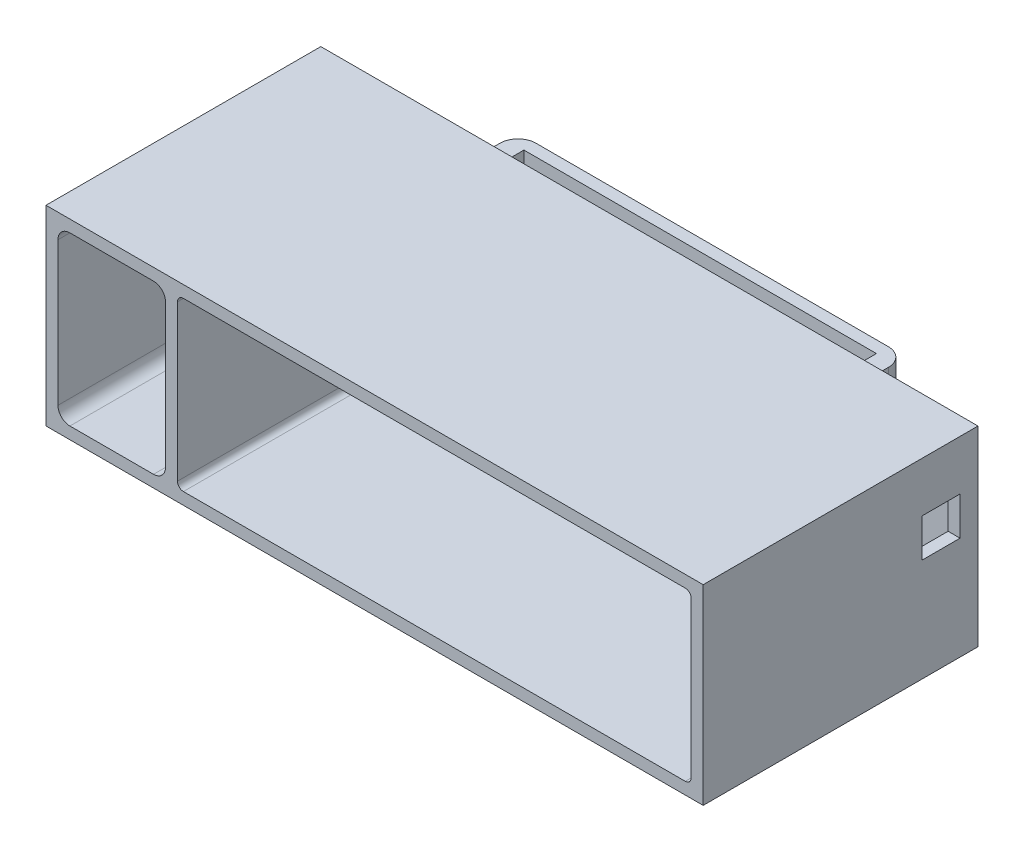
from build123d import *

# Parameters (mm, degrees)
ESQUISSE1_W             = 90
ESQUISSE1_H             = 32
BOSS_EXTRU_1_DEPTH      = 2
ESQUISSE2_W             = 90
ESQUISSE2_H             = 32
ESQUISSE2_W_2           = 86
ESQUISSE2_H_2           = 28
BOSS_EXTRU_3_DEPTH      = 45
ENL_V_MAT_EXTRU_1_REACH = 108.457
ESQUISSE3_W             = 6.41
ESQUISSE3_H             = 6.41
CONG_3_R                = 1
CHANFREIN8_SIZE         = 1
ESQUISSE7_W             = 65
ESQUISSE7_H             = 24
BOSS_EXTRU_8_DEPTH      = 7
CONG_11_R               = 3
CONG_12_R               = 3
ESQUISSE17_W            = 59
ESQUISSE17_H            = 5
ENL_V_MAT_EXTRU_6_DEPTH = 24
ESQUISSE20_W            = 46
ESQUISSE20_H            = 32
BOSS_EXTRU_10_DEPTH     = 20
ESQUISSE21_W            = 18
ESQUISSE21_H            = 28
ENL_V_MAT_EXTRU_7_DEPTH = 43
CONG_13_R               = 2
CONG_14_R               = 2
CONG_15_R               = 2
CONG_16_R               = 2
ESQUISSE22_W            = 3
ESQUISSE22_H            = 16
ENL_V_MAT_EXTRU_8_DEPTH = 2


with BuildPart() as part:
    # Esquisse1 → Boss.-Extru.1 (new body)
    with BuildSketch(Plane.XY):
        with Locations((45, 16)):
            Rectangle(ESQUISSE1_W, ESQUISSE1_H)
    extrude(amount=BOSS_EXTRU_1_DEPTH)

    # Esquisse2 → Boss.-Extru.3 (add)
    with BuildSketch(Plane.XY.offset(2)):
        with Locations((45, 16)):
            Rectangle(ESQUISSE2_W, ESQUISSE2_H)
        with Locations((45, 16)):
            Rectangle(ESQUISSE2_W_2, ESQUISSE2_H_2, mode=Mode.SUBTRACT)
    extrude(amount=BOSS_EXTRU_3_DEPTH)

    # Esquisse3 → Enlèv. mat.-Extru.1 (cut, up to next)
    with BuildSketch(Plane(origin=(90, 0, 0), x_dir=(0, 0, -1), z_dir=(1, 0, 0)), mode=Mode.PRIVATE) as enl_v_mat_extru_1_sk1:
        with Locations((-7.205, 20.445)):
            Rectangle(ESQUISSE3_W, ESQUISSE3_H)
    enl_v_mat_extru_1_tool1 = extrude(enl_v_mat_extru_1_sk1.sketch, amount=-ENL_V_MAT_EXTRU_1_REACH, mode=Mode.PRIVATE) & part.part
    add(enl_v_mat_extru_1_tool1.solids().sort_by_distance((90, 20.445, 7.205))[0], mode=Mode.SUBTRACT)

    # Congé3
    cong_3_edges = [part.edges().sort_by_distance(p)[0] for p in [
        (45, 2, 2),
        (88, 16, 2),
        (45, 30, 2),
        (2, 16, 2),
        (88, 2, 24.5),
        (88, 30, 24.5),
        (2, 30, 24.5),
        (2, 2, 24.5),
    ]]
    fillet(cong_3_edges, radius=CONG_3_R)

    # Chanfrein8
    chanfrein8_edges = [part.edges().sort_by_distance(p)[0] for p in [
        (45, 32, 0),
        (90, 16, 0),
        (45, 0, 0),
        (0, 16, 0),
    ]]
    chamfer(chanfrein8_edges, length=CHANFREIN8_SIZE)

    # Esquisse7 → Boss.-Extru.8 (add)
    with BuildSketch(Plane(origin=(0, 0, 0), x_dir=(-1, 0, 0), z_dir=(0, 0, -1))):
        with Locations((-37.5, 16)):
            Rectangle(ESQUISSE7_W, ESQUISSE7_H)
    extrude(amount=BOSS_EXTRU_8_DEPTH)

    # Congé11
    cong_11_edges = [part.edges().sort_by_distance(p)[0] for p in [
        (5, 16, -7),
    ]]
    fillet(cong_11_edges, radius=CONG_11_R)

    # Congé12
    cong_12_edges = [part.edges().sort_by_distance(p)[0] for p in [
        (70, 16, -7),
    ]]
    fillet(cong_12_edges, radius=CONG_12_R)

    # Esquisse17 → Enlèv. mat.-Extru.6 (cut)
    with BuildSketch(Plane(origin=(0, 28, 0), x_dir=(1, 0, 0), z_dir=(0, 1, 0))):
        with Locations((37.5, 2.5)):
            Rectangle(ESQUISSE17_W, ESQUISSE17_H)
    extrude(amount=-ENL_V_MAT_EXTRU_6_DEPTH, mode=Mode.SUBTRACT)

    # Esquisse20 → Boss.-Extru.10 (add)
    with BuildSketch(Plane.ZY):
        with Locations((24, 16)):
            Rectangle(ESQUISSE20_W, ESQUISSE20_H)
    extrude(amount=BOSS_EXTRU_10_DEPTH)

    # Esquisse21 → Enlèv. mat.-Extru.7 (cut)
    with BuildSketch(Plane.XY.offset(47)):
        with Locations((-9, 16)):
            Rectangle(ESQUISSE21_W, ESQUISSE21_H)
    extrude(amount=-ENL_V_MAT_EXTRU_7_DEPTH, mode=Mode.SUBTRACT)

    # Congé13
    cong_13_edges = [part.edges().sort_by_distance(p)[0] for p in [
        (0, 30, 25.5),
    ]]
    fillet(cong_13_edges, radius=CONG_13_R)

    # Congé14
    cong_14_edges = [part.edges().sort_by_distance(p)[0] for p in [
        (-18, 30, 25.5),
    ]]
    fillet(cong_14_edges, radius=CONG_14_R)

    # Congé15
    cong_15_edges = [part.edges().sort_by_distance(p)[0] for p in [
        (0, 2, 25.5),
    ]]
    fillet(cong_15_edges, radius=CONG_15_R)

    # Congé16
    cong_16_edges = [part.edges().sort_by_distance(p)[0] for p in [
        (-18, 2, 25.5),
    ]]
    fillet(cong_16_edges, radius=CONG_16_R)

    # Esquisse22 → Enlèv. mat.-Extru.8 (cut)
    with BuildSketch(Plane(origin=(2, 0, 0), x_dir=(0, 0, -1), z_dir=(1, 0, 0))):
        with Locations((-5.5, 16)):
            Rectangle(ESQUISSE22_W, ESQUISSE22_H)
    extrude(amount=-ENL_V_MAT_EXTRU_8_DEPTH, mode=Mode.SUBTRACT)


solid = part.part
